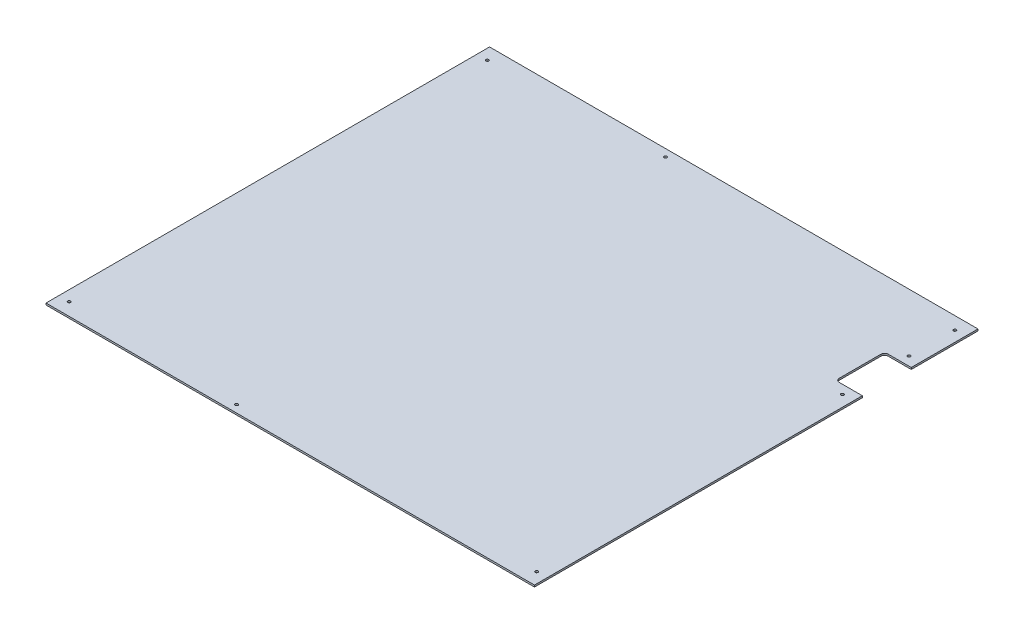
from build123d import *

# Parameters (mm, degrees)
CROQUIS1_W              = 550.5
CROQUIS1_H              = 500
SALIENTE_EXTRUIR1_DEPTH = 2
CROQUIS2_R              = 1.55
CORTAR_EXTRUIR1_DEPTH   = 2
CROQUIS3_W              = 550.5
CROQUIS3_H              = 500
CROQUIS3_W_2            = 549
CROQUIS3_H_2            = 498.5
CORTAR_EXTRUIR2_DEPTH   = 2
CROQUIS4_W              = 30
CROQUIS4_H              = 55
CORTAR_EXTRUIR3_DEPTH   = 2
REDONDEO1_R             = 4
CROQUIS5_R              = 1.6
CORTAR_EXTRUIR4_DEPTH   = 2
CROQUIS6_R              = 1.6
CORTAR_EXTRUIR5_DEPTH   = 2


with BuildPart() as part:
    # Croquis1 → Saliente-Extruir1 (new body)
    with BuildSketch(Plane(origin=(0, 0, 0), x_dir=(1, 0, 0), z_dir=(0, 1, 0))):
        with Locations((275.25, 250)):
            Rectangle(CROQUIS1_W, CROQUIS1_H)
    extrude(amount=SALIENTE_EXTRUIR1_DEPTH)

    # Croquis2 → Cortar-Extruir1 (cut)
    with BuildSketch(Plane(origin=(0, 2, 0), x_dir=(1, 0, 0), z_dir=(0, 1, 0))):
        with Locations(Location((12.5, 485, 0), (0, 0, 270))):
            Circle(CROQUIS2_R)
        with Locations(Location((538, 485, 0), (0, 0, 90))):
            Circle(CROQUIS2_R)
        with Locations(Location((538, 15, 0), (0, 0, 270))):
            Circle(CROQUIS2_R)
        with Locations(Location((12.5, 15, 0), (0, 0, 90))):
            Circle(CROQUIS2_R)
    extrude(amount=-CORTAR_EXTRUIR1_DEPTH, mode=Mode.SUBTRACT)

    # Croquis3 → Cortar-Extruir2 (cut)
    with BuildSketch(Plane(origin=(0, 2, 0), x_dir=(1, 0, 0), z_dir=(0, 1, 0))):
        with Locations((275.25, 250)):
            Rectangle(CROQUIS3_W, CROQUIS3_H)
        with Locations((275.25, 250)):
            Rectangle(CROQUIS3_W_2, CROQUIS3_H_2, mode=Mode.SUBTRACT)
    extrude(amount=-CORTAR_EXTRUIR2_DEPTH, mode=Mode.SUBTRACT)

    # Croquis4 → Cortar-Extruir3 (cut)
    with BuildSketch(Plane(origin=(0, 2, 0), x_dir=(1, 0, 0), z_dir=(0, 1, 0))):
        with Locations((534.75, 396.75)):
            Rectangle(CROQUIS4_W, CROQUIS4_H)
    extrude(amount=-CORTAR_EXTRUIR3_DEPTH, mode=Mode.SUBTRACT)

    # Redondeo1
    redondeo1_edges = [part.edges().sort_by_distance(p)[0] for p in [
        (519.75, 1, -424.25),
        (519.75, 1, -369.25),
    ]]
    fillet(redondeo1_edges, radius=REDONDEO1_R)

    # Croquis5 → Cortar-Extruir4 (cut)
    with BuildSketch(Plane(origin=(0, 2, 0), x_dir=(1, 0, 0), z_dir=(0, 1, 0))):
        with Locations(Location((537.25, 434.25, 0), (0, 0, 270))):
            Circle(CROQUIS5_R)
        with Locations(Location((537.25, 359.25, 0), (0, 0, 270))):
            Circle(CROQUIS5_R)
    extrude(amount=-CORTAR_EXTRUIR4_DEPTH, mode=Mode.SUBTRACT)

    # Croquis6 → Cortar-Extruir5 (cut)
    with BuildSketch(Plane(origin=(0, 2, 0), x_dir=(1, 0, 0), z_dir=(0, 1, 0))):
        with Locations(Location((206.75, 491, 0), (0, 0, 270))):
            Circle(CROQUIS6_R)
        with Locations(Location((206.75, 9, 0), (0, 0, 270))):
            Circle(CROQUIS6_R)
    extrude(amount=-CORTAR_EXTRUIR5_DEPTH, mode=Mode.SUBTRACT)


solid = part.part
